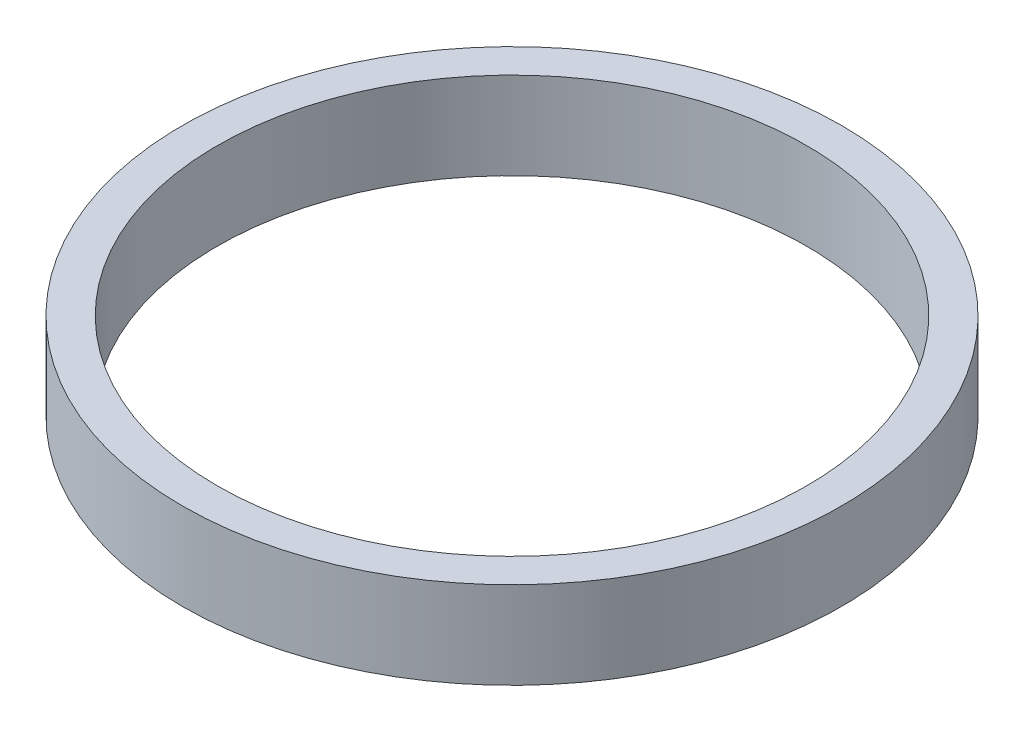
from build123d import *

# Parameters (mm, degrees)
SKETCH_1_R      = 11.35
SKETCH_1_R_2    = 10.15
EXTRUDE_1_DEPTH = 3


with BuildPart() as part:
    # 草图1 → 凸台-拉伸1 (new body)
    with BuildSketch(Plane(origin=(0, 0, 0), x_dir=(1, 0, 0), z_dir=(0, 1, 0))):
        with Locations(Location((0, 0, 0), (0, 0, 270))):
            Circle(SKETCH_1_R)
        with Locations(Location((0, 0, 0), (0, 0, 270))):
            Circle(SKETCH_1_R_2, mode=Mode.SUBTRACT)
    extrude(amount=EXTRUDE_1_DEPTH)


solid = part.part
